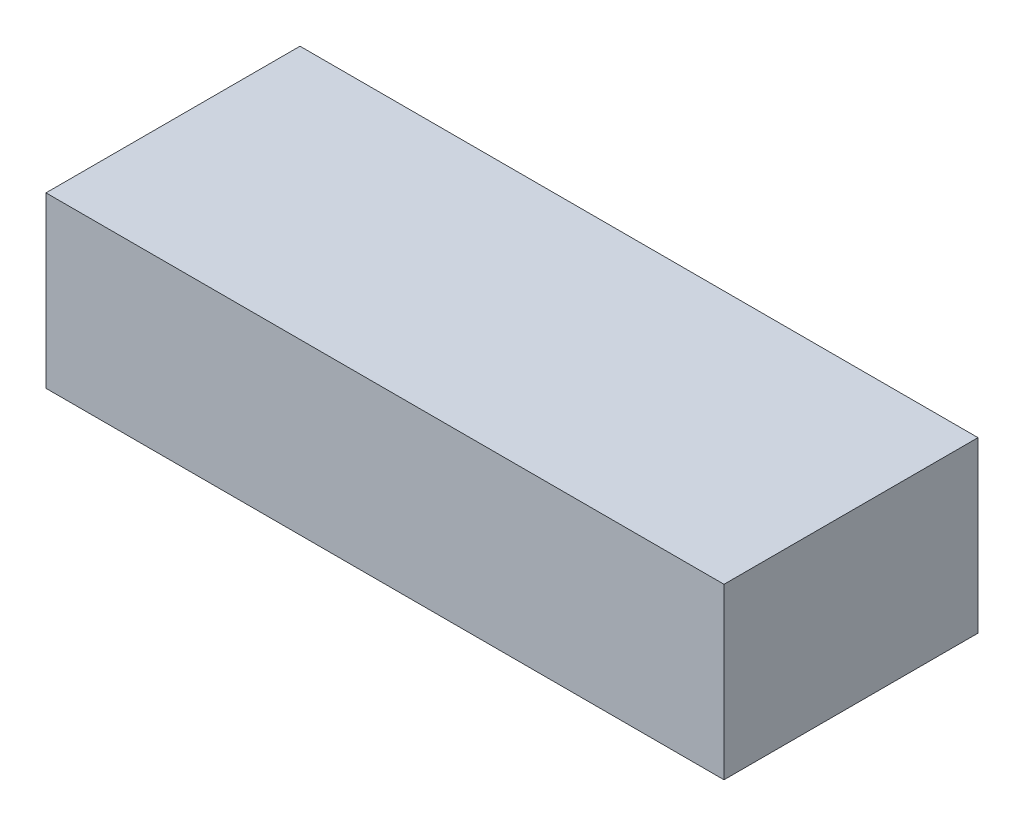
from build123d import *

# Parameters (mm, degrees)
SKETCH1_W           = 9770
SKETCH1_H           = 3660
BOSS_EXTRUDE1_DEPTH = 2440


with BuildPart() as part:
    # Sketch1 → Boss-Extrude1 (new body)
    with BuildSketch(Plane(origin=(0, 0, 0), x_dir=(1, 0, 0), z_dir=(0, 1, 0))):
        with Locations((4885, -1830)):
            Rectangle(SKETCH1_W, SKETCH1_H)
    extrude(amount=BOSS_EXTRUDE1_DEPTH)


solid = part.part
